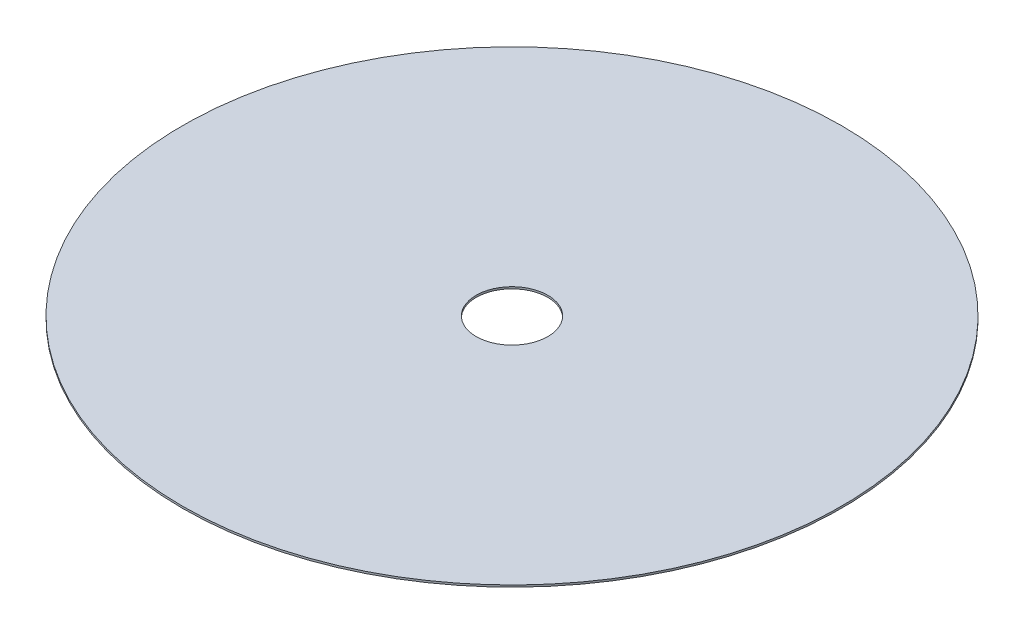
from build123d import *

# Parameters (mm, degrees)
SKETCH1_R           = 43.815
SKETCH1_R_2         = 4.7625
BOSS_EXTRUDE2_DEPTH = 0.254


with BuildPart() as part:
    # Sketch1 → Boss-Extrude2 (new body)
    with BuildSketch(Plane(origin=(0, 0, 0), x_dir=(1, 0, 0), z_dir=(0, 1, 0))):
        Circle(SKETCH1_R)
        Circle(SKETCH1_R_2, mode=Mode.SUBTRACT)
    extrude(amount=BOSS_EXTRUDE2_DEPTH)


solid = part.part
